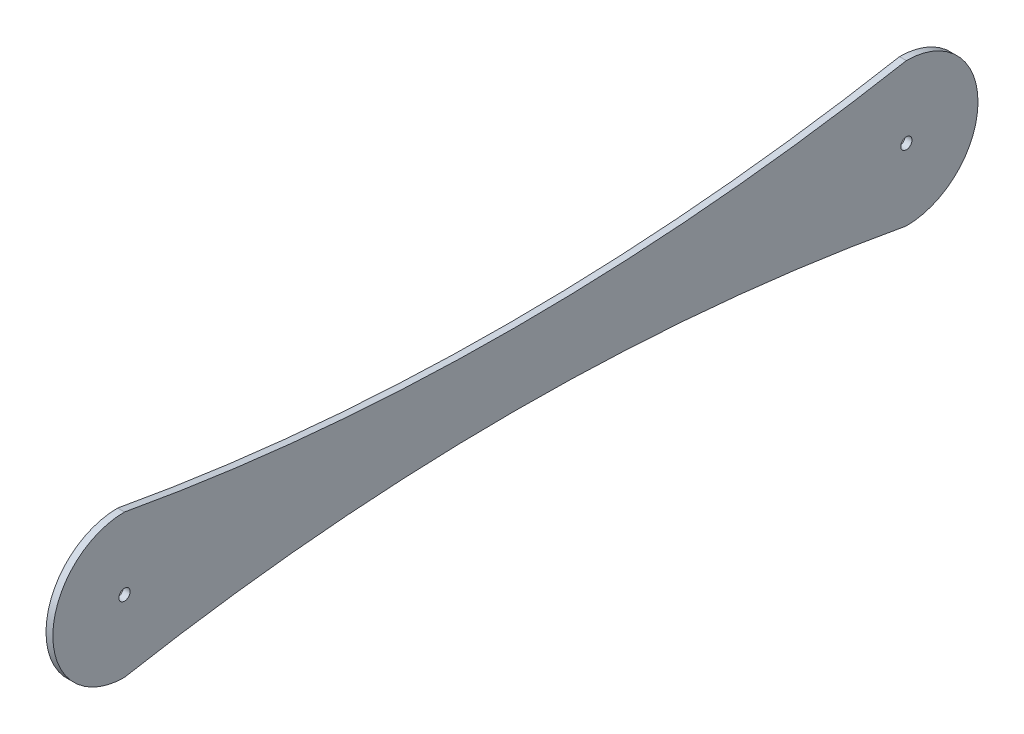
from build123d import *

# Parameters (mm, degrees)
SKETCH1_R           = 2.4892
BOSS_EXTRUDE1_DEPTH = 3.03784


with BuildPart() as part:
    # Sketch1 → Boss-Extrude1 (new body)
    with BuildSketch(Plane(origin=(0, 0, 0), x_dir=(0, 0, -1), z_dir=(1, 0, 0))):
        with BuildLine():
            ThreePointArc((-173.355, 31.75), (-205.105, 0), (-173.355, -31.75))
            ThreePointArc((-173.355, -31.75), (0, -15.969504771), (173.355, -31.75))
            ThreePointArc((173.355, -31.75), (205.105, 0), (173.355, 31.75))
            ThreePointArc((173.355, 31.75), (0, 15.969504771), (-173.355, 31.75))
        make_face()
        with Locations((-173.355, 0)):
            Circle(SKETCH1_R, mode=Mode.SUBTRACT)
        with Locations((173.355, 0)):
            Circle(SKETCH1_R, mode=Mode.SUBTRACT)
    extrude(amount=BOSS_EXTRUDE1_DEPTH)


solid = part.part
